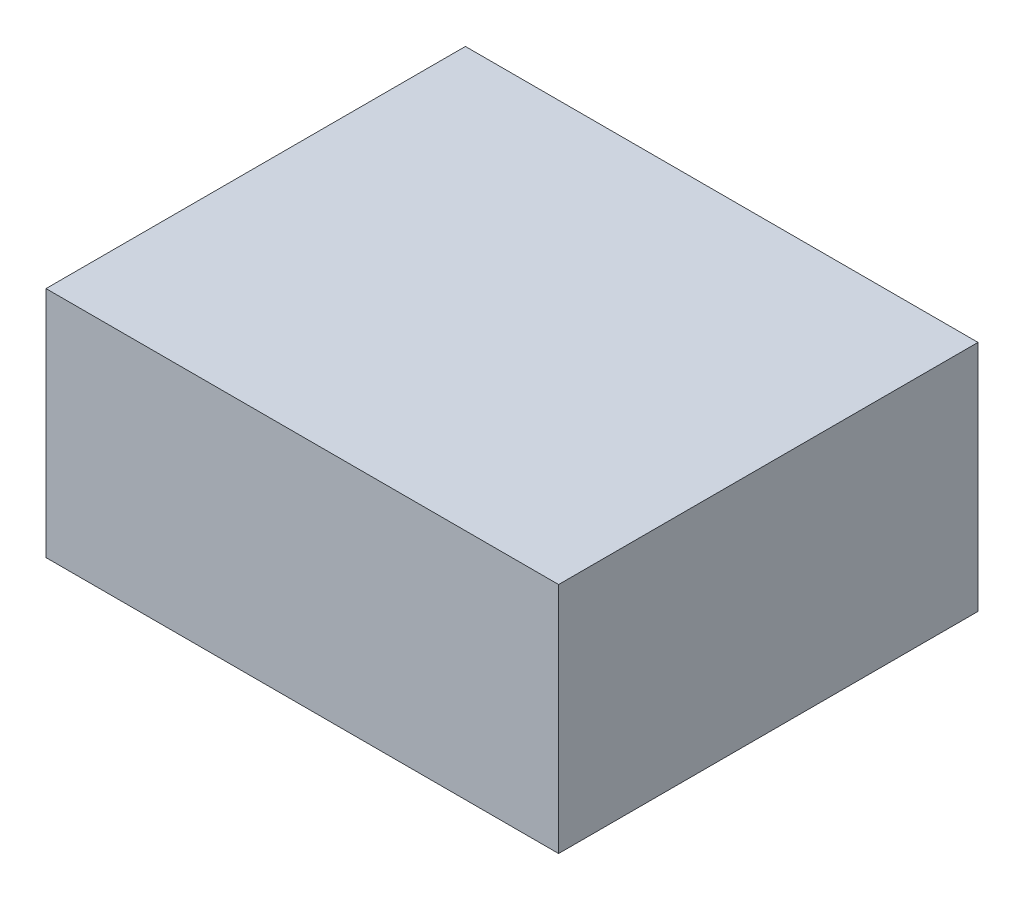
from build123d import *

# Parameters (mm, degrees)
SKETCH1_W           = 69.85
SKETCH1_H           = 57.15
BOSS_EXTRUDE1_DEPTH = 31.75


with BuildPart() as part:
    # Sketch1 → Boss-Extrude1 (new body)
    with BuildSketch(Plane(origin=(0, 0, 0), x_dir=(1, 0, 0), z_dir=(0, 1, 0))):
        with Locations((34.925, 28.575)):
            Rectangle(SKETCH1_W, SKETCH1_H)
    extrude(amount=BOSS_EXTRUDE1_DEPTH)


solid = part.part
